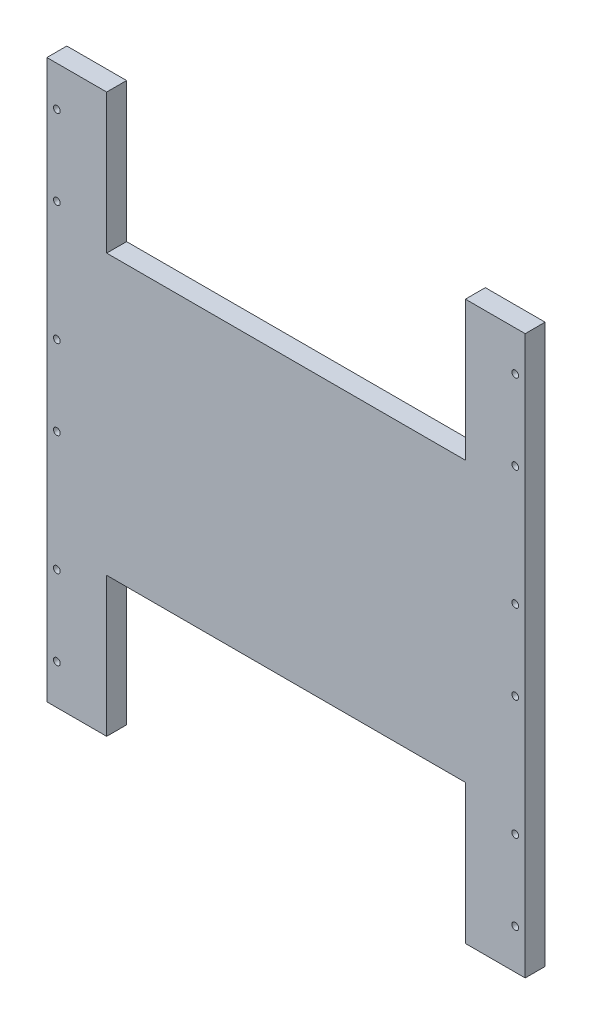
from build123d import *

# Parameters (mm, degrees)
SKETCH1_W           = 304.8
SKETCH1_H           = 355.6
BOSS_EXTRUDE1_DEPTH = 12.7
SKETCH2_W           = 228.6
SKETCH2_H           = 88.9
CUT_EXTRUDE1_DEPTH  = 469.525015341
SKETCH3_R           = 2.159
CUT_EXTRUDE2_DEPTH  = 469.525015341


with BuildPart() as part:
    # Sketch1 → Boss-Extrude1 (new body)
    with BuildSketch(Plane.XY):
        with Locations((152.4, 177.8)):
            Rectangle(SKETCH1_W, SKETCH1_H)
    extrude(amount=BOSS_EXTRUDE1_DEPTH)

    # Sketch2 → Cut-Extrude1 (cut, through all)
    with BuildSketch(Plane.XY.offset(12.7)):
        with Locations((152.4, 44.45)):
            Rectangle(SKETCH2_W, SKETCH2_H)
        with Locations((152.4, 311.15)):
            Rectangle(SKETCH2_W, SKETCH2_H)
    extrude(amount=-CUT_EXTRUDE1_DEPTH, mode=Mode.SUBTRACT)

    # Sketch3 → Cut-Extrude2 (cut, through all)
    with BuildSketch(Plane.XY.offset(12.7)):
        with Locations((6.35, 330.2)):
            Circle(SKETCH3_R)
        with Locations((6.35, 279.4)):
            Circle(SKETCH3_R)
        with Locations(Location((6.35, 76.2, 0), (0, 0, 180))):
            Circle(SKETCH3_R)
        with Locations(Location((6.35, 25.4, 0), (0, 0, 180))):
            Circle(SKETCH3_R)
        with Locations((298.45, 25.4)):
            Circle(SKETCH3_R)
        with Locations((298.45, 76.2)):
            Circle(SKETCH3_R)
        with Locations(Location((298.45, 279.4, 0), (0, 0, 180))):
            Circle(SKETCH3_R)
        with Locations(Location((298.45, 330.2, 0), (0, 0, 180))):
            Circle(SKETCH3_R)
        with Locations(Location((6.35, 203.2, 0), (0, 0, 180))):
            Circle(SKETCH3_R)
        with Locations(Location((6.35, 152.4, 0), (0, 0, 180))):
            Circle(SKETCH3_R)
        with Locations((298.45, 152.4)):
            Circle(SKETCH3_R)
        with Locations((298.45, 203.2)):
            Circle(SKETCH3_R)
    extrude(amount=-CUT_EXTRUDE2_DEPTH, mode=Mode.SUBTRACT)


solid = part.part
